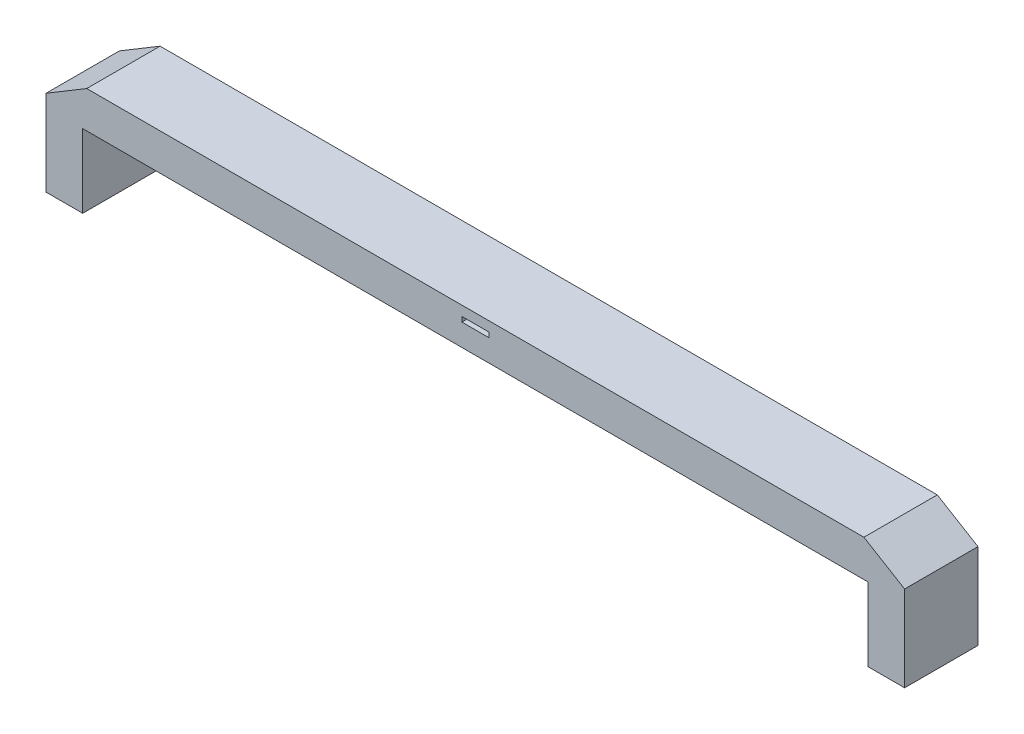
from build123d import *
from OCP.BRepFilletAPI import BRepFilletAPI_MakeChamfer

# Parameters (mm, degrees)
SKETCH1_W           = 321
SKETCH1_H           = 30
BOSS_EXTRUDE1_DEPTH = 15
SKETCH2_W           = 15
SKETCH2_H           = 30
BOSS_EXTRUDE2_DEPTH = 45
SKETCH3_W           = 40
SKETCH3_H           = 30
BOSS_EXTRUDE3_DEPTH = 0.0001
SKETCH4_W           = 11
SKETCH4_H           = 2
CUT_EXTRUDE1_DEPTH  = 7.2
CHAMFER1_SIZE       = 10
CHAMFER1_SIZE2      = 16.642794824


with BuildPart() as part:
    # Sketch1 → Boss-Extrude1 (new body)
    with BuildSketch(Plane(origin=(0, 0, 0), x_dir=(1, 0, 0), z_dir=(0, 1, 0))):
        with Locations((-160.5, -15)):
            Rectangle(SKETCH1_W, SKETCH1_H)
    extrude(amount=BOSS_EXTRUDE1_DEPTH)

    # Sketch2 → Boss-Extrude2 (add)
    with BuildSketch(Plane(origin=(0, 15, 0), x_dir=(1, 0, 0), z_dir=(0, 1, 0))):
        with Locations((-328.5, -15)):
            Rectangle(SKETCH2_W, SKETCH2_H)
        with Locations((7.5, -15)):
            Rectangle(SKETCH2_W, SKETCH2_H)
    extrude(amount=-BOSS_EXTRUDE2_DEPTH)

    # Sketch3 → Boss-Extrude3 (add)
    with BuildSketch(Plane.XZ):
        with Locations((-160.5, 15)):
            Rectangle(SKETCH3_W, SKETCH3_H)
    extrude(amount=BOSS_EXTRUDE3_DEPTH)

    # Sketch4 → Cut-Extrude1 (cut)
    with BuildSketch(Plane.XY.offset(30)):
        with Locations((-160.5, 10)):
            Rectangle(SKETCH4_W, SKETCH4_H)
    extrude(amount=-CUT_EXTRUDE1_DEPTH, mode=Mode.SUBTRACT)

    # Chamfer1: one chamfer whose edges measure the first distance from different faces: ONE call of the kernel's chamfer builder (chamfer() names one face for all edges)
    chamfer1_edges_1 = [part.edges().sort_by_distance(p)[0] for p in [
        (-336, 15, 15),
    ]]
    chamfer1_side_1 = [part.faces().sort_by_distance(p)[0] for p in [
        (-336, -7.5, 15),
    ]]
    chamfer1_edges_2 = [part.edges().sort_by_distance(p)[0] for p in [
        (15, 15, 15),
    ]]
    chamfer1_side_2 = [part.faces().sort_by_distance(p)[0] for p in [
        (15, -7.5, 15),
    ]]
    chamfer1 = BRepFilletAPI_MakeChamfer(part.part.solid().wrapped)
    for e in chamfer1_edges_1:
        chamfer1.Add(CHAMFER1_SIZE, CHAMFER1_SIZE2, e.wrapped, chamfer1_side_1[0].wrapped)  # the first distance lies on this face
    for e in chamfer1_edges_2:
        chamfer1.Add(CHAMFER1_SIZE, CHAMFER1_SIZE2, e.wrapped, chamfer1_side_2[0].wrapped)  # the first distance lies on this face
    add(Compound.cast(chamfer1.Shape()), mode=Mode.REPLACE)


solid = part.part
